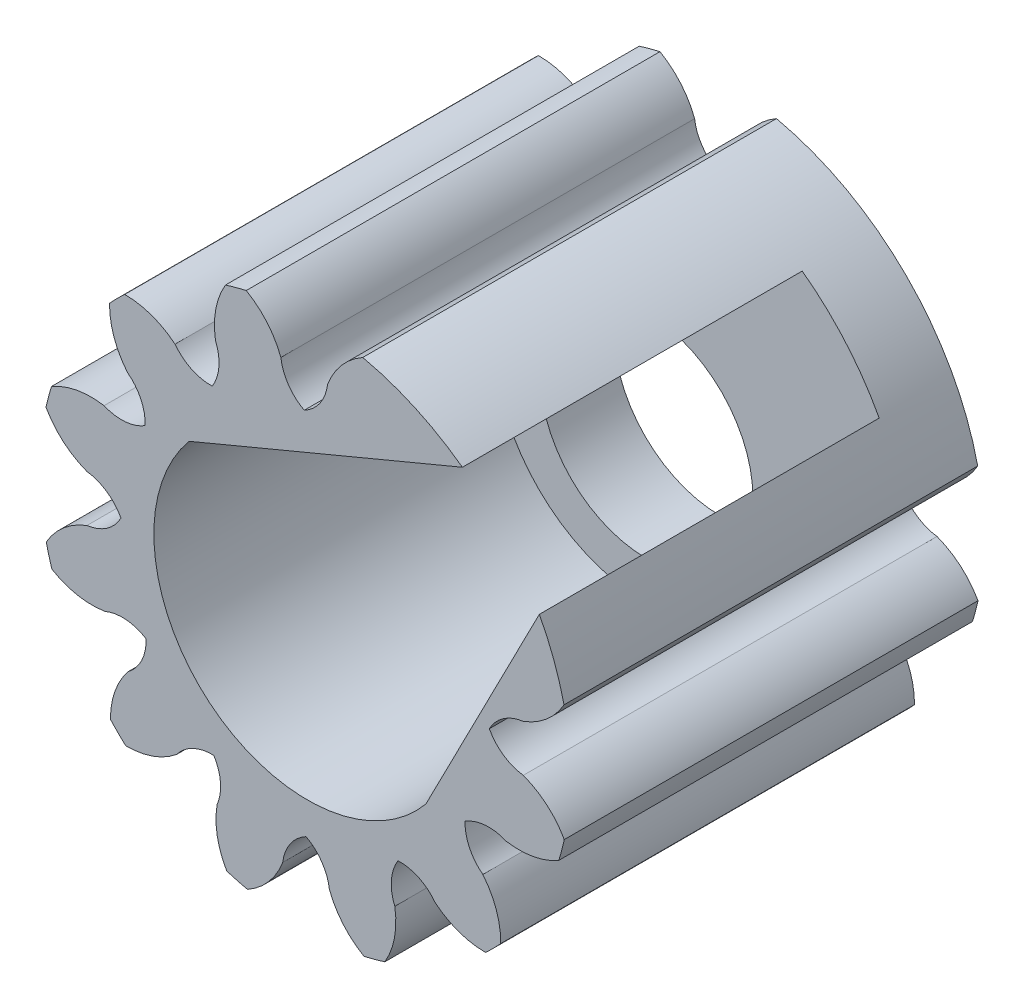
from build123d import *

# Parameters (mm, degrees)
SKETCH1_R           = 8.98338725
BOSS_EXTRUDE2_DEPTH = 14
CUT_EXTRUDE1_DEPTH  = 11.5
SKETCH9_R           = 3.6
CUT_EXTRUDE4_DEPTH  = 14
CUT_EXTRUDE5_DEPTH  = 14
CIRPATTERN2_COUNT   = 10
CIRPATTERN2_ANGLE   = 270


with BuildPart() as part:
    # Sketch1 → Boss-Extrude2 (new body)
    with BuildSketch(Plane.XY):
        Circle(SKETCH1_R)
    extrude(amount=-BOSS_EXTRUDE2_DEPTH)

    # Sketch2 → Cut-Extrude1 (cut)
    with BuildSketch(Plane.XY):
        with BuildLine():
            Line((-3.928824085, 3.374352944), (5.321370473, 7.237697339))
            ThreePointArc((5.321370473, 7.237697339), (6.791881958, 5.879760705), (7.925211932, 4.229924623))
            Line((7.925211932, 4.229924623), (4.087244411, -3.247616683))
            ThreePointArc((4.087244411, -3.247616683), (-3.231774651, -3.944666118), (-3.928824085, 3.374352944))
        make_face()
    extrude(amount=-CUT_EXTRUDE1_DEPTH, mode=Mode.SUBTRACT)

    # Sketch9 → Cut-Extrude4 (cut)
    with BuildSketch(Plane.XY):
        with Locations((0.051031531, -0.220189823)):
            Circle(SKETCH9_R)
    extrude(amount=-CUT_EXTRUDE4_DEPTH, mode=Mode.SUBTRACT)

    # Sketch10 → Cut-Extrude5 (cut)
    with BuildSketch(Plane.XY):
        with BuildLine():
            ThreePointArc((-0.030614018, 6.232538227), (0.505170096, 6.710825662), (0.759385982, 7.382538227))
            ThreePointArc((0.759385982, 7.382538227), (1.276411254, 8.232191257), (2.069385982, 8.832538227))
            ThreePointArc((2.069385982, 8.832538227), (-0.030614018, 8.990934274), (-2.130614018, 8.832538227))
            ThreePointArc((-2.130614018, 8.832538227), (-1.33763929, 8.232191257), (-0.820614018, 7.382538227))
            ThreePointArc((-0.820614018, 7.382538227), (-0.566398131, 6.710825662), (-0.030614018, 6.232538227))
        make_face()
    cut_extrude5 = extrude(amount=-CUT_EXTRUDE5_DEPTH, mode=Mode.SUBTRACT)

    # CirPattern2: Cut-Extrude5 ×10 about axis
    cirpattern2_axis = Axis((0, 0, 0), (0, 0, 1))
    for i in range(1, CIRPATTERN2_COUNT):
        add(cut_extrude5.rotate(cirpattern2_axis, i * CIRPATTERN2_ANGLE / (CIRPATTERN2_COUNT - 1)), mode=Mode.SUBTRACT)


solid = part.part
